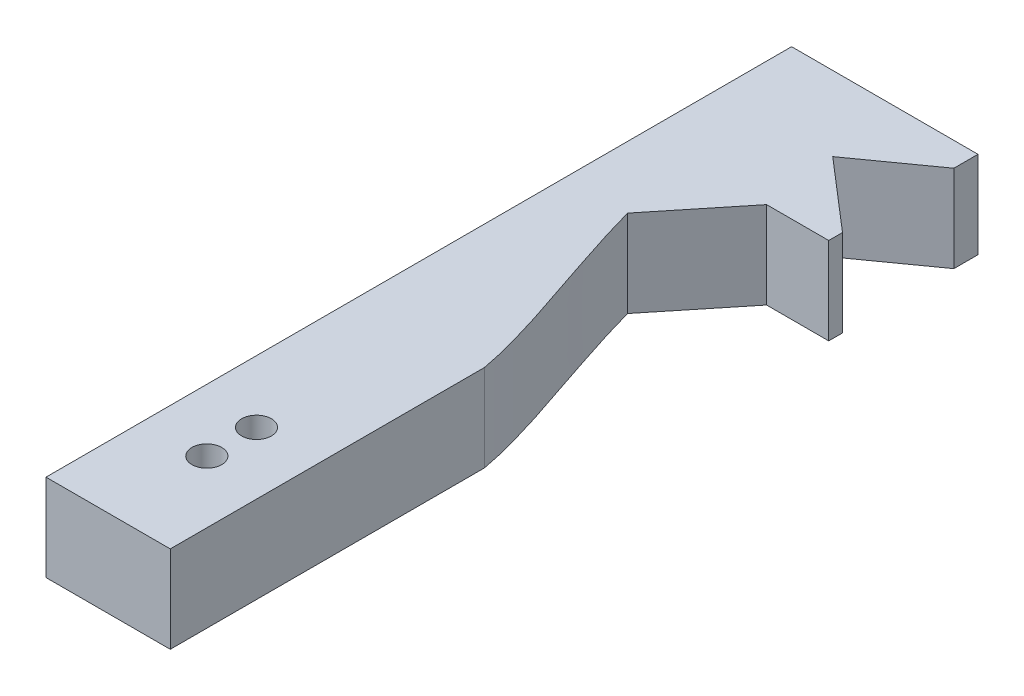
from build123d import *

# Parameters (mm, degrees)
BOSS_EXTRUDE1_DEPTH = 7
SKETCH2_W           = 12.012879562
SKETCH2_H           = 7
BOSS_EXTRUDE3_DEPTH = 5
CUT_EXTRUDE1_DEPTH  = 33.388269627
SKETCH4_R           = 1.2
CUT_EXTRUDE2_DEPTH  = 33.388269627


with BuildPart() as part:
    # Sketch1 → Boss-Extrude1 (new body)
    with BuildSketch(Plane(origin=(0, 0, 0), x_dir=(1, 0, 0), z_dir=(0, 1, 0))):
        with BuildLine():
            add(Edge.make_bspline(
                [(0, 11.802718513), (1.58072242, 5.981279649), (4.167222532, -0.050595561), (5, -4.726791588)],
                knots=[0.482657311, 0.482657311, 0.482657311, 0.482657311, 0.853883687, 0.853883687, 0.853883687, 0.853883687], degree=3))
            Line((0, 11.802718513), (5, 17.987120438))
            Line((5, 17.987120438), (5, 30))
            Line((5, 30), (-5, 30))
            Line((-5, 30), (-5, -30))
            Line((-5, -30), (5, -30))
            Line((5, -30), (5, -4.726791588))
        make_face()
    extrude(amount=BOSS_EXTRUDE1_DEPTH)

    # Sketch2 → Boss-Extrude3 (add)
    with BuildSketch(Plane(origin=(5, 0, 0), x_dir=(0, 0, -1), z_dir=(1, 0, 0))):
        with Locations((23.993560219, 3.5)):
            Rectangle(SKETCH2_W, SKETCH2_H)
    extrude(amount=BOSS_EXTRUDE3_DEPTH)

    # Sketch3 → Cut-Extrude1 (cut, through all)
    with BuildSketch(Plane(origin=(0, 7, 0), x_dir=(1, 0, 0), z_dir=(0, 1, 0))):
        Polygon((10, 28.05876983), (4.315561677, 23.993560219), (10, 19.0964891), align=None)
    extrude(amount=-CUT_EXTRUDE1_DEPTH, mode=Mode.SUBTRACT)

    # Sketch4 → Cut-Extrude2 (cut, through all)
    with BuildSketch(Plane(origin=(0, 7, 0), x_dir=(1, 0, 0), z_dir=(0, 1, 0))):
        with Locations(Location((0, -22.059676008, 0), (0, 0, 270))):
            Circle(SKETCH4_R)
        with Locations(Location((0, -18.059676008, 0), (0, 0, 270))):
            Circle(SKETCH4_R)
    extrude(amount=-CUT_EXTRUDE2_DEPTH, mode=Mode.SUBTRACT)


solid = part.part
